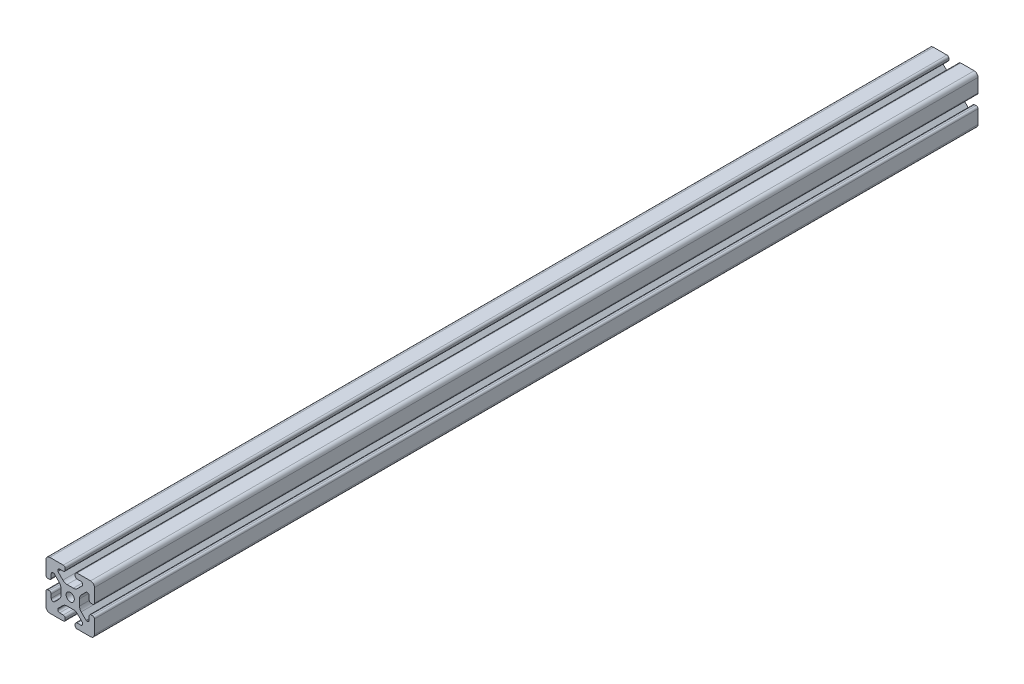
from build123d import *

# Parameters (mm, degrees)
SKETCH1_R           = 3.4
BOSS_EXTRUDE1_DEPTH = 4000
SKETCH2_W           = 84.539567645
SKETCH2_H           = 98.688701394
CUT_EXTRUDE1_DEPTH  = 3271.122321871


with BuildPart() as part:
    # Sketch1 → Boss-Extrude1 (new body)
    with BuildSketch(Plane(origin=(0, 0, -4000), x_dir=(-1, 0, 0), z_dir=(0, 0, -1))):
        with BuildLine():
            Line((16.83, 20), (5.69044933, 20))
            ThreePointArc((5.69044933, 20), (4.580291684, 19.540157646), (4.12044933, 18.43))
            Line((4.12044933, 18.43), (4.12044933, 17.25))
            ThreePointArc((4.12044933, 17.25), (4.580291684, 16.139842354), (5.69044933, 15.68))
            Line((5.69044933, 15.68), (8.7153995, 15.68))
            ThreePointArc((8.7153995, 15.68), (9.825557146, 15.220157646), (10.2853995, 14.11))
            Line((10.2853995, 14.11), (10.2853995, 13.654903102))
            ThreePointArc((10.2853995, 13.654903102), (10.227547945, 13.364063694), (10.062800654, 13.117501948))
            Line((10.062800654, 13.117501948), (6.055092794, 9.109794088))
            ThreePointArc((6.055092794, 9.109794088), (4.47691877, 8.055291919), (2.615335582, 7.685))
            Line((2.615335582, 7.685), (-2.615335582, 7.685))
            ThreePointArc((-2.615335582, 7.685), (-4.47691877, 8.055291919), (-6.055092794, 9.109794088))
            Line((-6.055092794, 9.109794088), (-10.062800654, 13.117501948))
            ThreePointArc((-10.062800654, 13.117501948), (-10.227547945, 13.364063694), (-10.2853995, 13.654903102))
            Line((-10.2853995, 13.654903102), (-10.2853995, 14.11))
            ThreePointArc((-10.2853995, 14.11), (-9.825557146, 15.220157646), (-8.7153995, 15.68))
            Line((-8.7153995, 15.68), (-5.69044933, 15.68))
            ThreePointArc((-5.69044933, 15.68), (-4.580291684, 16.139842354), (-4.12044933, 17.25))
            Line((-4.12044933, 17.25), (-4.12044933, 18.43))
            ThreePointArc((-4.12044933, 18.43), (-4.580291684, 19.540157646), (-5.69044933, 20))
            Line((-5.69044933, 20), (-16.83, 20))
            ThreePointArc((-16.83, 20), (-19.071528496, 19.071528496), (-20, 16.83))
            Line((-20, 16.83), (-20, 5.69044933))
            ThreePointArc((-20, 5.69044933), (-19.540157646, 4.580291684), (-18.43, 4.12044933))
            Line((-18.43, 4.12044933), (-17.25, 4.12044933))
            ThreePointArc((-17.25, 4.12044933), (-16.139842354, 4.580291684), (-15.68, 5.69044933))
            Line((-15.68, 5.69044933), (-15.68, 8.7153995))
            ThreePointArc((-15.68, 8.7153995), (-15.220157646, 9.825557146), (-14.11, 10.2853995))
            Line((-14.11, 10.2853995), (-13.654903102, 10.2853995))
            ThreePointArc((-13.654903102, 10.2853995), (-13.364063694, 10.227547945), (-13.117501948, 10.062800654))
            Line((-13.117501948, 10.062800654), (-9.109794088, 6.055092794))
            ThreePointArc((-9.109794088, 6.055092794), (-8.055291919, 4.47691877), (-7.685, 2.615335582))
            Line((-7.685, 2.615335582), (-7.685, -2.615335582))
            ThreePointArc((-7.685, -2.615335582), (-8.055291919, -4.47691877), (-9.109794088, -6.055092794))
            Line((-9.109794088, -6.055092794), (-13.117501948, -10.062800654))
            ThreePointArc((-13.117501948, -10.062800654), (-13.364063694, -10.227547945), (-13.654903102, -10.2853995))
            Line((-13.654903102, -10.2853995), (-14.11, -10.2853995))
            ThreePointArc((-14.11, -10.2853995), (-15.220157646, -9.825557146), (-15.68, -8.7153995))
            Line((-15.68, -8.7153995), (-15.68, -5.69044933))
            ThreePointArc((-15.68, -5.69044933), (-16.139842354, -4.580291684), (-17.25, -4.12044933))
            Line((-17.25, -4.12044933), (-18.43, -4.12044933))
            ThreePointArc((-18.43, -4.12044933), (-19.540157646, -4.580291684), (-20, -5.69044933))
            Line((-20, -5.69044933), (-20, -16.83))
            ThreePointArc((-20, -16.83), (-19.071528496, -19.071528496), (-16.83, -20))
            Line((-16.83, -20), (-5.69044933, -20))
            ThreePointArc((-5.69044933, -20), (-4.580291684, -19.540157646), (-4.12044933, -18.43))
            Line((-4.12044933, -18.43), (-4.12044933, -17.25))
            ThreePointArc((-4.12044933, -17.25), (-4.580291684, -16.139842354), (-5.69044933, -15.68))
            Line((-5.69044933, -15.68), (-8.7153995, -15.68))
            ThreePointArc((-8.7153995, -15.68), (-9.825557146, -15.220157646), (-10.2853995, -14.11))
            Line((-10.2853995, -14.11), (-10.2853995, -13.654903102))
            ThreePointArc((-10.2853995, -13.654903102), (-10.227547945, -13.364063694), (-10.062800654, -13.117501948))
            Line((-10.062800654, -13.117501948), (-6.055092794, -9.109794088))
            ThreePointArc((-6.055092794, -9.109794088), (-4.47691877, -8.055291919), (-2.615335582, -7.685))
            Line((-2.615335582, -7.685), (2.615335582, -7.685))
            ThreePointArc((2.615335582, -7.685), (4.47691877, -8.055291919), (6.055092794, -9.109794088))
            Line((6.055092794, -9.109794088), (10.062800654, -13.117501948))
            ThreePointArc((10.062800654, -13.117501948), (10.227547945, -13.364063694), (10.2853995, -13.654903102))
            Line((10.2853995, -13.654903102), (10.2853995, -14.11))
            ThreePointArc((10.2853995, -14.11), (9.825557146, -15.220157646), (8.7153995, -15.68))
            Line((8.7153995, -15.68), (5.69044933, -15.68))
            ThreePointArc((5.69044933, -15.68), (4.580291684, -16.139842354), (4.12044933, -17.25))
            Line((4.12044933, -17.25), (4.12044933, -18.43))
            ThreePointArc((4.12044933, -18.43), (4.580291684, -19.540157646), (5.69044933, -20))
            Line((5.69044933, -20), (16.83, -20))
            ThreePointArc((16.83, -20), (19.071528496, -19.071528496), (20, -16.83))
            Line((20, -16.83), (20, -5.69044933))
            ThreePointArc((20, -5.69044933), (19.540157646, -4.580291684), (18.43, -4.12044933))
            Line((18.43, -4.12044933), (17.25, -4.12044933))
            ThreePointArc((17.25, -4.12044933), (16.139842354, -4.580291684), (15.68, -5.69044933))
            Line((15.68, -5.69044933), (15.68, -8.7153995))
            ThreePointArc((15.68, -8.7153995), (15.220157646, -9.825557146), (14.11, -10.2853995))
            Line((14.11, -10.2853995), (13.654903102, -10.2853995))
            ThreePointArc((13.654903102, -10.2853995), (13.364063694, -10.227547945), (13.117501948, -10.062800654))
            Line((13.117501948, -10.062800654), (9.109794088, -6.055092794))
            ThreePointArc((9.109794088, -6.055092794), (8.055291919, -4.47691877), (7.685, -2.615335582))
            Line((7.685, -2.615335582), (7.685, 2.615335582))
            ThreePointArc((7.685, 2.615335582), (8.055291919, 4.47691877), (9.109794088, 6.055092794))
            Line((9.109794088, 6.055092794), (13.117501948, 10.062800654))
            ThreePointArc((13.117501948, 10.062800654), (13.364063694, 10.227547945), (13.654903102, 10.2853995))
            Line((13.654903102, 10.2853995), (14.11, 10.2853995))
            ThreePointArc((14.11, 10.2853995), (15.220157646, 9.825557146), (15.68, 8.7153995))
            Line((15.68, 8.7153995), (15.68, 5.69044933))
            ThreePointArc((15.68, 5.69044933), (16.139842354, 4.580291684), (17.25, 4.12044933))
            Line((17.25, 4.12044933), (18.43, 4.12044933))
            ThreePointArc((18.43, 4.12044933), (19.540157646, 4.580291684), (20, 5.69044933))
            Line((20, 5.69044933), (20, 16.83))
            ThreePointArc((20, 16.83), (19.071528496, 19.071528496), (16.83, 20))
        make_face()
        with Locations(Location((0, 0, 0), (0, 0, 180))):
            Circle(SKETCH1_R, mode=Mode.SUBTRACT)
    extrude(amount=-BOSS_EXTRUDE1_DEPTH)

    # Sketch2 → Cut-Extrude1 (cut, through all)
    with BuildSketch(Plane.XY.offset(-730)):
        with Locations((6.865320367, -4.171878069)):
            Rectangle(SKETCH2_W, SKETCH2_H)
    extrude(amount=-CUT_EXTRUDE1_DEPTH, mode=Mode.SUBTRACT)


solid = part.part
